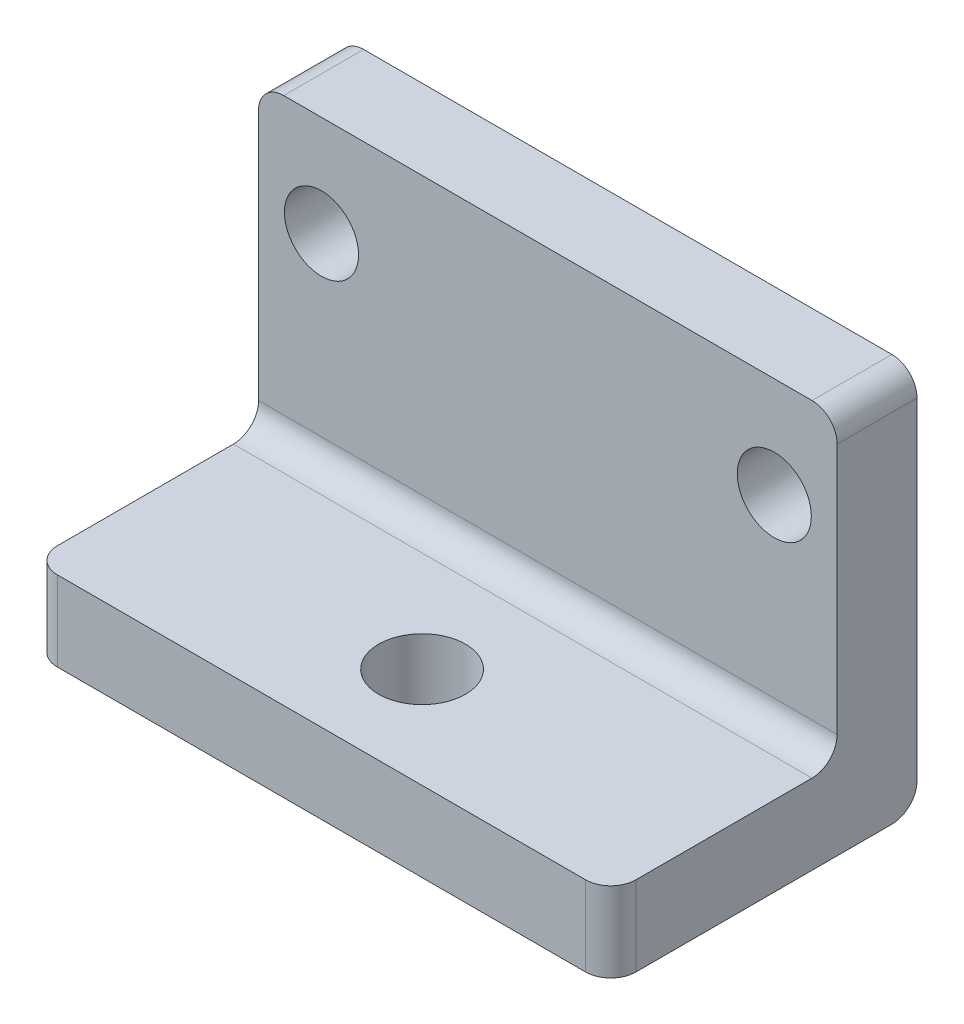
from build123d import *

# Parameters (mm, degrees)
SKETCH1_W             = 23
SKETCH1_H             = 10
SKETCH1_R             = 1.4732
SKETCH1_H_2           = 3.175
SKETCH1_H_3           = 2
BOSS_EXTRUDE1_DEPTH   = 3.175
BOSS_EXTRUDE2_START   = 3.175
SKETCH1_3_W           = 23
SKETCH1_3_H           = 3.175
BOSS_EXTRUDE2_DEPTH   = 9
F_8_32_TAPPED_HOLE1_D = 3.4544
FILLET1_R             = 1


with BuildPart() as part:
    # Sketch1 → Boss-Extrude1 (new body)
    # profile 1 of 3: a face of its own
    with BuildSketch(Plane.XY):
        with Locations((11.5, -5)):
            Rectangle(SKETCH1_W, SKETCH1_H)
        with Locations((2.5, -2)):
            Circle(SKETCH1_R, mode=Mode.SUBTRACT)
        with Locations((20.5, -2)):
            Circle(SKETCH1_R, mode=Mode.SUBTRACT)
    # profile 2 of 3: a face of its own
    with BuildSketch(Plane.XY):
        with Locations((11.5, -11.5875)):
            Rectangle(SKETCH1_W, SKETCH1_H_2)
    # profile 3 of 3: a face of its own
    with BuildSketch(Plane.XY):
        with Locations((11.5, 1)):
            Rectangle(SKETCH1_W, SKETCH1_H_3)
    extrude(amount=BOSS_EXTRUDE1_DEPTH)

    # Sketch1<3> → Boss-Extrude2 (add)
    with BuildSketch(Plane.XY.offset(BOSS_EXTRUDE2_START)):
        with Locations((11.5, -11.5875)):
            Rectangle(SKETCH1_3_W, SKETCH1_3_H)
    extrude(amount=BOSS_EXTRUDE2_DEPTH)

    # #8-32 Tapped Hole1 (through all)
    with Locations(Plane(origin=(11.5, -10, 8.175), x_dir=(1, 0, 0), z_dir=(0, 1, 0))):
        with Locations((0, 0)):
            Hole(F_8_32_TAPPED_HOLE1_D / 2)

    # Fillet1
    fillet1_edges = [part.edges().sort_by_distance(p)[0] for p in [
        (0, 2, 1.5875),
        (23, 2, 1.5875),
        (0, -11.5875, 12.175),
        (11.5, -10, 3.175),
        (23, -11.5875, 12.175),
        (11.5, -13.175, 0),
    ]]
    fillet(fillet1_edges, radius=FILLET1_R)


solid = part.part
